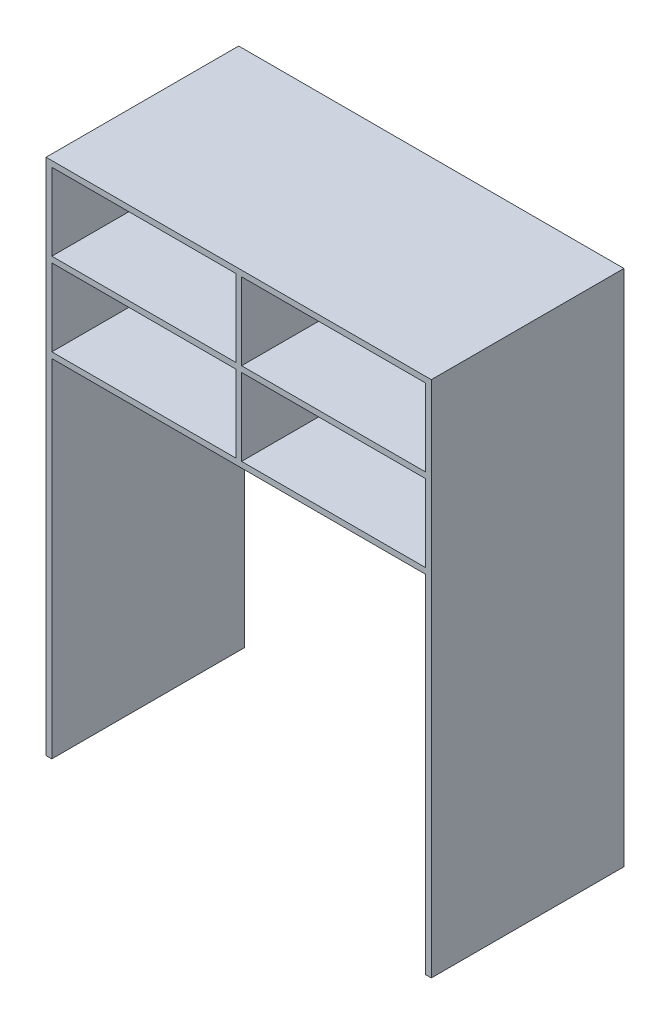
from build123d import *

# Parameters (mm, degrees)
SKETCH1_W           = 95.5
SKETCH1_H           = 40
BOSS_EXTRUDE1_DEPTH = 100


with BuildPart() as part:
    # Sketch1 → Boss-Extrude1 (new body)
    with BuildSketch(Plane.XY):
        Polygon((-97, 0), (97, 0), (97, -180), (100, -180), (100, 89), (-100, 89), (-100, -180), (-97, -180), align=None)
        with Locations((-49.25, 23)):
            Rectangle(SKETCH1_W, SKETCH1_H, mode=Mode.SUBTRACT)
        with Locations((-49.25, 66)):
            Rectangle(SKETCH1_W, SKETCH1_H, mode=Mode.SUBTRACT)
        with Locations((49.25, 66)):
            Rectangle(SKETCH1_W, SKETCH1_H, mode=Mode.SUBTRACT)
        with Locations((49.25, 23)):
            Rectangle(SKETCH1_W, SKETCH1_H, mode=Mode.SUBTRACT)
    extrude(amount=BOSS_EXTRUDE1_DEPTH)


solid = part.part
